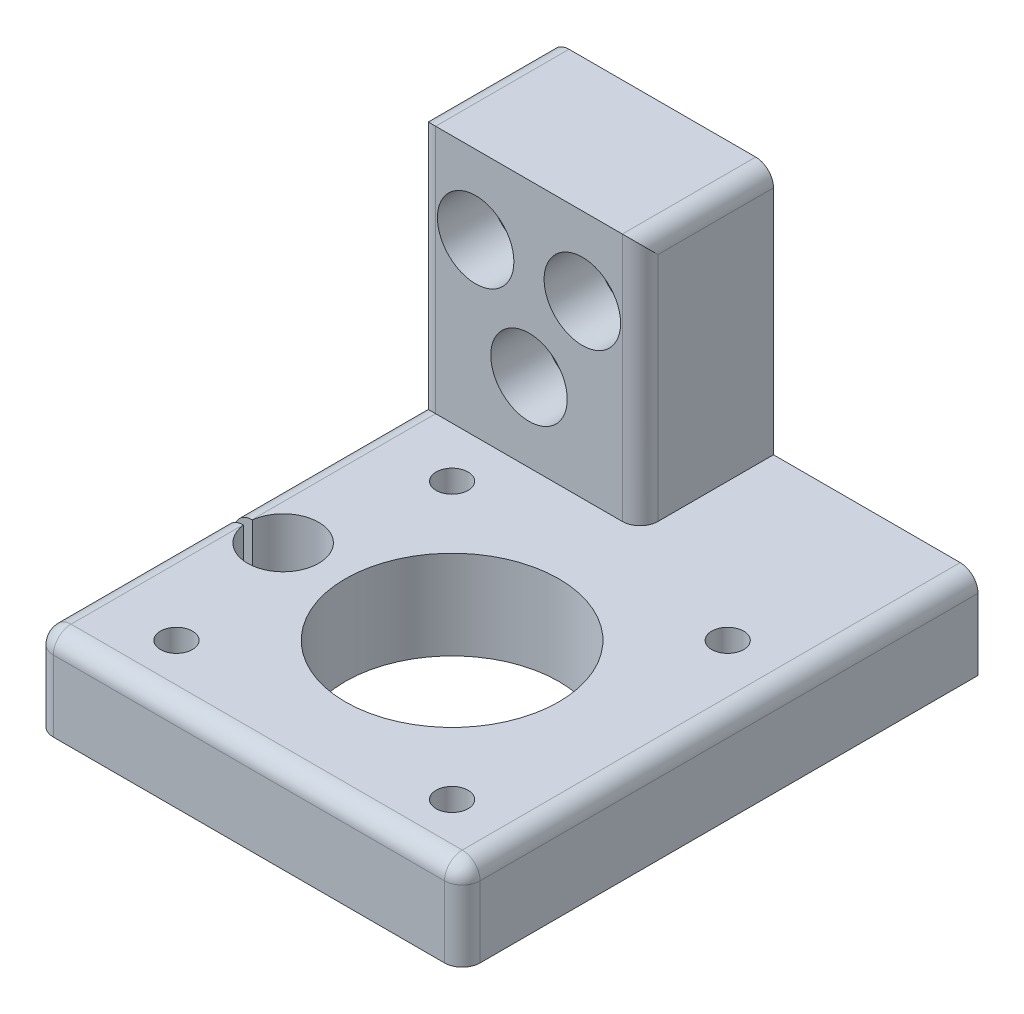
from build123d import *

# Parameters (mm, degrees)
SKETCH1_R           = 1.8
SKETCH1_R_2         = 12
BOSS_EXTRUDE1_DEPTH = 10
SKETCH2_W           = 15
SKETCH2_H           = 28
BOSS_EXTRUDE2_DEPTH = 25
SKETCH3_R           = 2.8
CUT_EXTRUDE1_DEPTH  = 75.813100457
SKETCH4_R           = 4.3
CUT_EXTRUDE2_DEPTH  = 6
FILLET1_R           = 2


with BuildPart() as part:
    # Sketch1 → Boss-Extrude1 (new body)
    with BuildSketch(Plane(origin=(0, 0, 0), x_dir=(1, 0, 0), z_dir=(0, 1, 0))):
        with BuildLine():
            Line((48, 0), (0, 0))
            Line((0, 0), (0, -35.65))
            Line((0, -35.65), (2.031373033, -35.65))
            ThreePointArc((2.031373033, -35.65), (6.25049165, -32.157850963), (10, -36.15))
            ThreePointArc((10, -36.15), (6.25049165, -40.142149037), (2.031373033, -36.65))
            Line((2.031373033, -36.65), (0, -36.65))
            Line((0, -36.65), (0, -58))
            Line((0, -58), (48, -58))
            Line((48, -58), (48, 0))
        make_face()
        with Locations(Location((9.5, -51.65, 0), (0, 0, 270))):
            Circle(SKETCH1_R, mode=Mode.SUBTRACT)
        with Locations(Location((40.5, -51.65, 0), (0, 0, 270))):
            Circle(SKETCH1_R, mode=Mode.SUBTRACT)
        with Locations(Location((25, -36.15, 0), (0, 0, 270))):
            Circle(SKETCH1_R_2, mode=Mode.SUBTRACT)
        with Locations(Location((9.5, -20.65, 0), (0, 0, 270))):
            Circle(SKETCH1_R, mode=Mode.SUBTRACT)
        with Locations(Location((40.5, -20.65, 0), (0, 0, 270))):
            Circle(SKETCH1_R, mode=Mode.SUBTRACT)
    extrude(amount=BOSS_EXTRUDE1_DEPTH)

    # Sketch2 → Boss-Extrude2 (add)
    with BuildSketch(Plane(origin=(0, 0, 0), x_dir=(0, 0, -1), z_dir=(1, 0, 0))):
        with Locations((-7.5, 24)):
            Rectangle(SKETCH2_W, SKETCH2_H)
    extrude(amount=BOSS_EXTRUDE2_DEPTH)

    # Sketch3 → Cut-Extrude1 (cut, through all)
    with BuildSketch(Plane.XY.offset(15)):
        with Locations((6.5, 29.196152423)):
            Circle(SKETCH3_R)
        with Locations((18.5, 29.196152423)):
            Circle(SKETCH3_R)
        with Locations((12.5, 18.803847577)):
            Circle(SKETCH3_R)
    extrude(amount=-CUT_EXTRUDE1_DEPTH, mode=Mode.SUBTRACT)

    # Sketch4 → Cut-Extrude2 (cut)
    with BuildSketch(Plane.XY.offset(15)):
        with Locations((6.5, 29.196152423)):
            Circle(SKETCH4_R)
        with Locations((18.5, 29.196152423)):
            Circle(SKETCH4_R)
        with Locations((12.5, 18.803847577)):
            Circle(SKETCH4_R)
    extrude(amount=-CUT_EXTRUDE2_DEPTH, mode=Mode.SUBTRACT)

    # Fillet1
    fillet1_edges = [part.edges().sort_by_distance(p)[0] for p in [
        (0, 10, 47.325),
        (24, 10, 58),
        (48, 5, 58),
        (0, 5, 58),
        (48, 10, 29),
        (0, 10, 25.325),
        (0, 38, 7.5),
        (0, 24, 15),
        (25, 38, 7.5),
        (25, 24, 15),
    ]]
    fillet(fillet1_edges, radius=FILLET1_R)


solid = part.part
